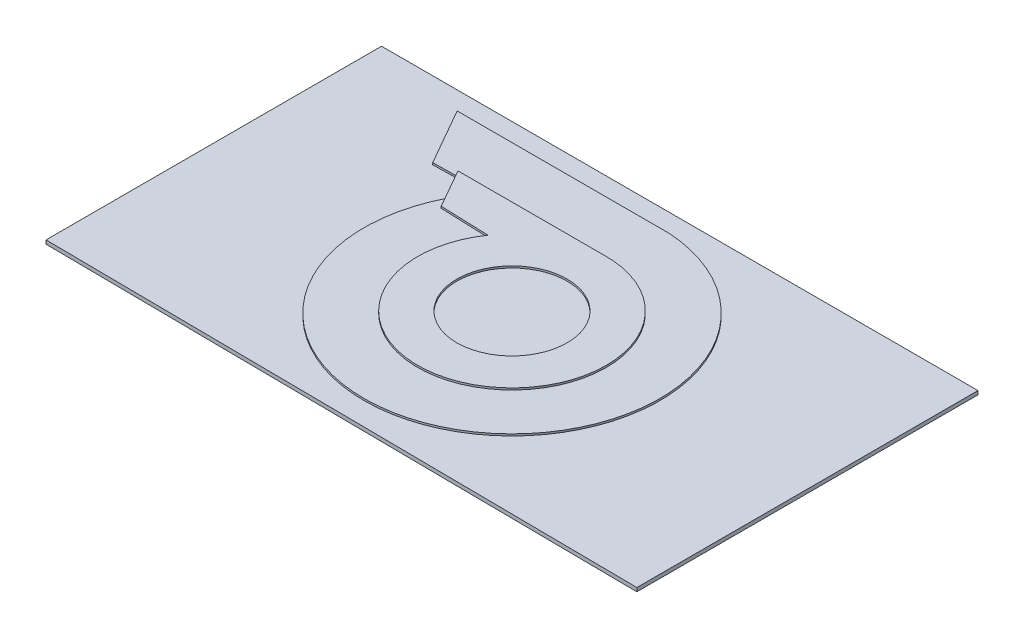
from build123d import *

# Parameters (mm, degrees)
BOSS_EXTRUDE1_DEPTH = 1
BOSS_EXTRUDE2_DEPTH = 2.7
SKETCH5_OUTSIDE_W   = 198.872
SKETCH5_OUTSIDE_H   = 130.378
SKETCH5_OUTSIDE_R   = 3
CUT_EXTRUDE1_DEPTH  = 2
BOSS_EXTRUDE3_DEPTH = 0.5
BOSS_EXTRUDE4_DEPTH = 1
CUT_EXTRUDE2_START  = 0.5
SKETCH9_R           = 14.807450978
CUT_EXTRUDE2_DEPTH  = 0.5


with BuildPart() as part:
    # Sketch3 → Boss-Extrude1 (new body)
    with BuildSketch(Plane(origin=(0, 0, 0), x_dir=(1, 0, 0), z_dir=(0, 1, 0))):
        Polygon((-80, 45), (80, 45), (80, -46.505636843), (-80, -45), align=None)
    extrude(amount=BOSS_EXTRUDE1_DEPTH)

    # Sketch4 → Boss-Extrude2 (add)
    with BuildSketch(Plane.XZ):
        with BuildLine():
            Line((-70.35, 37.979513383), (-70.35, 32.020486617))
            add(Edge.make_bspline(
                [(-70.35, 37.979513383), (-73.35, 37.979513383), (-73.35, 35), (-73.35, 32.020486617), (-70.35, 32.020486617)],
                knots=[4.71238898, 4.71238898, 4.71238898, 6.283185307, 6.283185307, 7.853981634, 7.853981634, 7.853981634], degree=2, weights=[1, 0.707106781, 1, 0.707106781, 1]))
        make_face()
        with BuildLine():
            Line((-69.65, 37.979513383), (-69.65, 32.020486617))
            add(Edge.make_bspline(
                [(-69.65, 32.020486617), (-66.65, 32.020486617), (-66.65, 35), (-66.65, 37.979513383), (-69.65, 37.979513383)],
                knots=[4.71238898, 4.71238898, 4.71238898, 6.283185307, 6.283185307, 7.853981634, 7.853981634, 7.853981634], degree=2, weights=[1, 0.707106781, 1, 0.707106781, 1]))
        make_face()
        with BuildLine():
            Line((69.65, 37.979513383), (69.65, 32.020486617))
            add(Edge.make_bspline(
                [(69.65, 37.979513383), (66.65, 37.979513383), (66.65, 35), (66.65, 32.020486617), (69.65, 32.020486617)],
                knots=[4.71238898, 4.71238898, 4.71238898, 6.283185307, 6.283185307, 7.853981634, 7.853981634, 7.853981634], degree=2, weights=[1, 0.707106781, 1, 0.707106781, 1]))
        make_face()
        with BuildLine():
            Line((70.35, 37.979513383), (70.35, 32.020486617))
            add(Edge.make_bspline(
                [(70.35, 32.020486617), (73.35, 32.020486617), (73.35, 35), (73.35, 37.979513383), (70.35, 37.979513383)],
                knots=[4.71238898, 4.71238898, 4.71238898, 6.283185307, 6.283185307, 7.853981634, 7.853981634, 7.853981634], degree=2, weights=[1, 0.707106781, 1, 0.707106781, 1]))
        make_face()
        with BuildLine():
            Line((69.65, -32.020486617), (69.65, -37.979513383))
            add(Edge.make_bspline(
                [(69.65, -32.020486617), (66.65, -32.020486617), (66.65, -35), (66.65, -37.979513383), (69.65, -37.979513383)],
                knots=[4.71238898, 4.71238898, 4.71238898, 6.283185307, 6.283185307, 7.853981634, 7.853981634, 7.853981634], degree=2, weights=[1, 0.707106781, 1, 0.707106781, 1]))
        make_face()
        with BuildLine():
            Line((70.35, -32.020486617), (70.35, -37.979513383))
            add(Edge.make_bspline(
                [(70.35, -37.979513383), (73.35, -37.979513383), (73.35, -35), (73.35, -32.020486617), (70.35, -32.020486617)],
                knots=[4.71238898, 4.71238898, 4.71238898, 6.283185307, 6.283185307, 7.853981634, 7.853981634, 7.853981634], degree=2, weights=[1, 0.707106781, 1, 0.707106781, 1]))
        make_face()
        with BuildLine():
            Line((-70.35, -32.020486617), (-70.35, -37.979513383))
            add(Edge.make_bspline(
                [(-70.35, -32.020486617), (-73.35, -32.020486617), (-73.35, -35), (-73.35, -37.979513383), (-70.35, -37.979513383)],
                knots=[4.71238898, 4.71238898, 4.71238898, 6.283185307, 6.283185307, 7.853981634, 7.853981634, 7.853981634], degree=2, weights=[1, 0.707106781, 1, 0.707106781, 1]))
        make_face()
        with BuildLine():
            Line((-69.65, -32.020486617), (-69.65, -37.979513383))
            add(Edge.make_bspline(
                [(-69.65, -37.979513383), (-66.65, -37.979513383), (-66.65, -35), (-66.65, -32.020486617), (-69.65, -32.020486617)],
                knots=[4.71238898, 4.71238898, 4.71238898, 6.283185307, 6.283185307, 7.853981634, 7.853981634, 7.853981634], degree=2, weights=[1, 0.707106781, 1, 0.707106781, 1]))
        make_face()
    extrude(amount=BOSS_EXTRUDE2_DEPTH)

    # Sketch5 outside → Cut-Extrude1 (cut)
    with BuildSketch(Plane.XZ):
        with Locations((0, 0.753)):
            Rectangle(SKETCH5_OUTSIDE_W, SKETCH5_OUTSIDE_H)
        with Locations((-70, 35)):
            Circle(SKETCH5_OUTSIDE_R, mode=Mode.SUBTRACT)
        with Locations((70, 35)):
            Circle(SKETCH5_OUTSIDE_R, mode=Mode.SUBTRACT)
        with Locations((70, -35)):
            Circle(SKETCH5_OUTSIDE_R, mode=Mode.SUBTRACT)
        with Locations((-70, -35)):
            Circle(SKETCH5_OUTSIDE_R, mode=Mode.SUBTRACT)
    extrude(amount=CUT_EXTRUDE1_DEPTH, mode=Mode.SUBTRACT)

    # Sketch7 → Boss-Extrude3 (add)
    with BuildSketch(Plane(origin=(0, 1, 0), x_dir=(1, 0, 0), z_dir=(0, 1, 0))):
        with BuildLine():
            Line((-54.317045104, 39.602220595), (2.604668629, 39.602220595))
            ThreePointArc((2.604668629, 39.602220595), (16.151568109, -36.252545046), (-31.185365289, 24.547773147))
            Line((-31.185365289, 24.547773147), (-45.57985147, 24.320826837))
            Line((-45.57985147, 24.320826837), (-54.317045104, 39.602220595))
        make_face()
    extrude(amount=BOSS_EXTRUDE3_DEPTH)

    # Sketch8 → Boss-Extrude4 (add)
    with BuildSketch(Plane(origin=(0, 1, 0), x_dir=(1, 0, 0), z_dir=(0, 1, 0))):
        with BuildLine():
            Line((-39.773980052, 25.288720826), (-33.810282359, 14.830937097))
            Line((-33.810282359, 14.830937097), (-20.815447328, 14.373801562))
            ThreePointArc((-20.815447328, 14.373801562), (12.021833569, -22.256786301), (-0.607961992, 25.288720826))
            Line((-0.607961992, 25.288720826), (-39.773980052, 25.288720826))
        make_face()
    extrude(amount=BOSS_EXTRUDE4_DEPTH)

    # Sketch9 → Cut-Extrude2 (cut)
    with BuildSketch(Plane(origin=(0, 1, 0), x_dir=(1, 0, 0), z_dir=(0, 1, 0)).offset(CUT_EXTRUDE2_START)):
        with Locations(Location((0, 0, 0), (0, 0, 270))):
            Circle(SKETCH9_R)
    extrude(amount=CUT_EXTRUDE2_DEPTH, mode=Mode.SUBTRACT)


solid = part.part
